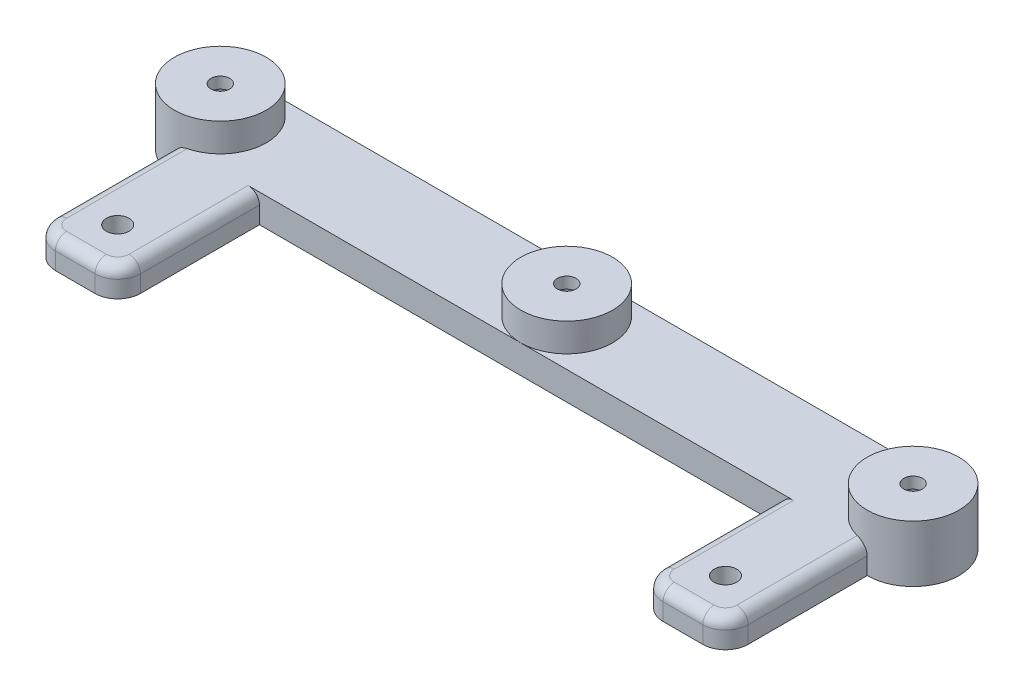
from build123d import *

# Parameters (mm, degrees)
SKETCH1_R           = 8.095
SKETCH1_R_2         = 2.65
SKETCH1_R_3         = 1.645
BOSS_EXTRUDE1_DEPTH = 5
BOSS_EXTRUDE2_START = 5
SKETCH1_3_R         = 8.095
SKETCH1_3_R_2       = 2.65
SKETCH1_3_R_3       = 1.645
BOSS_EXTRUDE2_DEPTH = 5
SKETCH1_4_R         = 2.65
SKETCH1_4_R_2       = 1.645
CUT_EXTRUDE1_DEPTH  = 8
SKETCH2_W           = 15
SKETCH2_H           = 5
BOSS_EXTRUDE3_DEPTH = 25
FILLET1_R           = 4
FILLET2_R           = 2
CUT_EXTRUDE2_REACH  = 79.342
SKETCH3_R           = 2


with BuildPart() as part:
    # Sketch1 → Boss-Extrude1 (new body)
    # profile 1 of 20: a face of its own
    with BuildSketch(Plane(origin=(0, 0, 0), x_dir=(1, 0, 0), z_dir=(0, 1, 0))):
        with BuildLine():
            ThreePointArc((-52.995, 0), (-55.365970606, 5.724029394), (-61.09, 8.095))
            Line((-61.09, 8.095), (-61.09, 2.65))
            ThreePointArc((-61.09, 2.65), (-59.21616703, 1.87383297), (-58.44, 0))
            ThreePointArc((-58.44, 0), (-59.21616703, -1.87383297), (-61.09, -2.65))
            Line((-61.09, -2.65), (-61.09, -8.095))
            ThreePointArc((-61.09, -8.095), (-55.365970606, -5.724029394), (-52.995, 0))
        make_face()
    # profile 2 of 20: a face of its own
    with BuildSketch(Plane(origin=(0, 0, 0), x_dir=(1, 0, 0), z_dir=(0, 1, 0))):
        with BuildLine():
            Line((-61.09, 2.65), (-61.09, 8.095))
            ThreePointArc((-61.09, 8.095), (-69.185, 0), (-61.09, -8.095))
            Line((-61.09, -8.095), (-61.09, -2.65))
            ThreePointArc((-61.09, -2.65), (-63.74, 0), (-61.09, 2.65))
        make_face()
    # profile 3 of 20: a face of its own
    with BuildSketch(Plane(origin=(0, 0, 0), x_dir=(1, 0, 0), z_dir=(0, 1, 0))):
        with BuildLine():
            ThreePointArc((-52.995, 0), (-55.365970606, 5.724029394), (-61.09, 8.095))
            Line((-61.09, 8.095), (-61.09, 2.65))
            ThreePointArc((-61.09, 2.65), (-59.21616703, 1.87383297), (-58.44, 0))
            ThreePointArc((-58.44, 0), (-59.21616703, -1.87383297), (-61.09, -2.65))
            Line((-61.09, -2.65), (-61.09, -8.095))
            ThreePointArc((-61.09, -8.095), (-55.365970606, -5.724029394), (-52.995, 0))
        make_face()
    # profile 4 of 20: a face of its own
    with BuildSketch(Plane(origin=(0, 0, 0), x_dir=(1, 0, 0), z_dir=(0, 1, 0))):
        with BuildLine():
            Line((-61.09, 2.65), (-61.09, 8.095))
            ThreePointArc((-61.09, 8.095), (-69.185, 0), (-61.09, -8.095))
            Line((-61.09, -8.095), (-61.09, -2.65))
            ThreePointArc((-61.09, -2.65), (-63.74, 0), (-61.09, 2.65))
        make_face()
    # profile 5 of 20: a face of its own
    with BuildSketch(Plane(origin=(0, 0, 0), x_dir=(1, 0, 0), z_dir=(0, 1, 0))):
        with BuildLine():
            ThreePointArc((-58.44, 0), (-59.21616703, 1.87383297), (-61.09, 2.65))
            Line((-61.09, 2.65), (-61.09, 1.645))
            ThreePointArc((-61.09, 1.645), (-59.926809345, 1.163190655), (-59.445, 0))
            ThreePointArc((-59.445, 0), (-59.926809345, -1.163190655), (-61.09, -1.645))
            Line((-61.09, -1.645), (-61.09, -2.65))
            ThreePointArc((-61.09, -2.65), (-59.21616703, -1.87383297), (-58.44, 0))
        make_face()
    # profile 6 of 20: a face of its own
    with BuildSketch(Plane(origin=(0, 0, 0), x_dir=(1, 0, 0), z_dir=(0, 1, 0))):
        with BuildLine():
            Line((-61.09, 1.645), (-61.09, 2.65))
            ThreePointArc((-61.09, 2.65), (-63.74, 0), (-61.09, -2.65))
            Line((-61.09, -2.65), (-61.09, -1.645))
            ThreePointArc((-61.09, -1.645), (-62.735, 0), (-61.09, 1.645))
        make_face()
    # profile 7 of 20: a face of its own
    with BuildSketch(Plane(origin=(0, 0, 0), x_dir=(1, 0, 0), z_dir=(0, 1, 0))):
        with BuildLine():
            ThreePointArc((-58.44, 0), (-59.21616703, 1.87383297), (-61.09, 2.65))
            Line((-61.09, 2.65), (-61.09, 1.645))
            ThreePointArc((-61.09, 1.645), (-59.926809345, 1.163190655), (-59.445, 0))
            ThreePointArc((-59.445, 0), (-59.926809345, -1.163190655), (-61.09, -1.645))
            Line((-61.09, -1.645), (-61.09, -2.65))
            ThreePointArc((-61.09, -2.65), (-59.21616703, -1.87383297), (-58.44, 0))
        make_face()
    # profile 8 of 20: a face of its own
    with BuildSketch(Plane(origin=(0, 0, 0), x_dir=(1, 0, 0), z_dir=(0, 1, 0))):
        with BuildLine():
            Line((-61.09, 1.645), (-61.09, 2.65))
            ThreePointArc((-61.09, 2.65), (-63.74, 0), (-61.09, -2.65))
            Line((-61.09, -2.65), (-61.09, -1.645))
            ThreePointArc((-61.09, -1.645), (-62.735, 0), (-61.09, 1.645))
        make_face()
    # profile 9 of 20: a face of its own
    with BuildSketch(Plane(origin=(0, 0, 0), x_dir=(1, 0, 0), z_dir=(0, 1, 0))):
        with BuildLine():
            Line((-3.7e-08, 8.095), (-61.09, 8.095))
            ThreePointArc((-61.09, 8.095), (-55.365970606, 5.724029394), (-52.995, 0))
            ThreePointArc((-52.995, 0), (-55.365970606, -5.724029394), (-61.09, -8.095))
            Line((-61.09, -8.095), (4.2e-08, -8.095))
            ThreePointArc((4.2e-08, -8.095), (-8.095, -4e-08), (-3.7e-08, 8.095))
        make_face()
    # profile 10 of 20: a face of its own
    with BuildSketch(Plane(origin=(0, 0, 0), x_dir=(1, 0, 0), z_dir=(0, 1, 0))):
        Circle(SKETCH1_R)
        Circle(SKETCH1_R_2, mode=Mode.SUBTRACT)
    # profile 11 of 20: a face of its own
    with BuildSketch(Plane(origin=(0, 0, 0), x_dir=(1, 0, 0), z_dir=(0, 1, 0))):
        Circle(SKETCH1_R_2)
        with Locations(Location((0, 0, 0), (0, 0, 270))):
            Circle(SKETCH1_R_3, mode=Mode.SUBTRACT)
    # profile 12 of 20: a face of its own
    with BuildSketch(Plane(origin=(0, 0, 0), x_dir=(1, 0, 0), z_dir=(0, 1, 0))):
        with BuildLine():
            Line((61.09, 8.095), (-3.7e-08, 8.095))
            ThreePointArc((-3.7e-08, 8.095), (5.724029381, 5.724029407), (8.095, 0))
            ThreePointArc((8.095, 0), (5.724029409, -5.724029379), (4.2e-08, -8.095))
            Line((4.2e-08, -8.095), (61.09, -8.095))
            ThreePointArc((61.09, -8.095), (52.995, 0), (61.09, 8.095))
        make_face()
    # profile 13 of 20: a face of its own
    with BuildSketch(Plane(origin=(0, 0, 0), x_dir=(1, 0, 0), z_dir=(0, 1, 0))):
        with BuildLine():
            ThreePointArc((69.185, 0), (66.814029394, 5.724029394), (61.09, 8.095))
            Line((61.09, 8.095), (61.09, 2.65))
            ThreePointArc((61.09, 2.65), (62.96383297, 1.87383297), (63.74, 0))
            ThreePointArc((63.74, 0), (62.96383297, -1.87383297), (61.09, -2.65))
            Line((61.09, -2.65), (61.09, -8.095))
            ThreePointArc((61.09, -8.095), (66.814029394, -5.724029394), (69.185, 0))
        make_face()
    # profile 14 of 20: a face of its own
    with BuildSketch(Plane(origin=(0, 0, 0), x_dir=(1, 0, 0), z_dir=(0, 1, 0))):
        with BuildLine():
            Line((61.09, 2.65), (61.09, 8.095))
            ThreePointArc((61.09, 8.095), (52.995, 0), (61.09, -8.095))
            Line((61.09, -8.095), (61.09, -2.65))
            ThreePointArc((61.09, -2.65), (58.44, 0), (61.09, 2.65))
        make_face()
    # profile 15 of 20: a face of its own
    with BuildSketch(Plane(origin=(0, 0, 0), x_dir=(1, 0, 0), z_dir=(0, 1, 0))):
        with BuildLine():
            ThreePointArc((69.185, 0), (66.814029394, 5.724029394), (61.09, 8.095))
            Line((61.09, 8.095), (61.09, 2.65))
            ThreePointArc((61.09, 2.65), (62.96383297, 1.87383297), (63.74, 0))
            ThreePointArc((63.74, 0), (62.96383297, -1.87383297), (61.09, -2.65))
            Line((61.09, -2.65), (61.09, -8.095))
            ThreePointArc((61.09, -8.095), (66.814029394, -5.724029394), (69.185, 0))
        make_face()
    # profile 16 of 20: a face of its own
    with BuildSketch(Plane(origin=(0, 0, 0), x_dir=(1, 0, 0), z_dir=(0, 1, 0))):
        with BuildLine():
            Line((61.09, 2.65), (61.09, 8.095))
            ThreePointArc((61.09, 8.095), (52.995, 0), (61.09, -8.095))
            Line((61.09, -8.095), (61.09, -2.65))
            ThreePointArc((61.09, -2.65), (58.44, 0), (61.09, 2.65))
        make_face()
    # profile 17 of 20: a face of its own
    with BuildSketch(Plane(origin=(0, 0, 0), x_dir=(1, 0, 0), z_dir=(0, 1, 0))):
        with BuildLine():
            ThreePointArc((63.74, 0), (62.96383297, 1.87383297), (61.09, 2.65))
            Line((61.09, 2.65), (61.09, 1.645))
            ThreePointArc((61.09, 1.645), (62.253190655, 1.163190655), (62.735, 0))
            ThreePointArc((62.735, 0), (62.253190655, -1.163190655), (61.09, -1.645))
            Line((61.09, -1.645), (61.09, -2.65))
            ThreePointArc((61.09, -2.65), (62.96383297, -1.87383297), (63.74, 0))
        make_face()
    # profile 18 of 20: a face of its own
    with BuildSketch(Plane(origin=(0, 0, 0), x_dir=(1, 0, 0), z_dir=(0, 1, 0))):
        with BuildLine():
            Line((61.09, 1.645), (61.09, 2.65))
            ThreePointArc((61.09, 2.65), (58.44, 0), (61.09, -2.65))
            Line((61.09, -2.65), (61.09, -1.645))
            ThreePointArc((61.09, -1.645), (59.445, 0), (61.09, 1.645))
        make_face()
    # profile 19 of 20: a face of its own
    with BuildSketch(Plane(origin=(0, 0, 0), x_dir=(1, 0, 0), z_dir=(0, 1, 0))):
        with BuildLine():
            ThreePointArc((63.74, 0), (62.96383297, 1.87383297), (61.09, 2.65))
            Line((61.09, 2.65), (61.09, 1.645))
            ThreePointArc((61.09, 1.645), (62.253190655, 1.163190655), (62.735, 0))
            ThreePointArc((62.735, 0), (62.253190655, -1.163190655), (61.09, -1.645))
            Line((61.09, -1.645), (61.09, -2.65))
            ThreePointArc((61.09, -2.65), (62.96383297, -1.87383297), (63.74, 0))
        make_face()
    # profile 20 of 20: a face of its own
    with BuildSketch(Plane(origin=(0, 0, 0), x_dir=(1, 0, 0), z_dir=(0, 1, 0))):
        with BuildLine():
            Line((61.09, 1.645), (61.09, 2.65))
            ThreePointArc((61.09, 2.65), (58.44, 0), (61.09, -2.65))
            Line((61.09, -2.65), (61.09, -1.645))
            ThreePointArc((61.09, -1.645), (59.445, 0), (61.09, 1.645))
        make_face()
    extrude(amount=BOSS_EXTRUDE1_DEPTH)

    # Sketch1<3> → Boss-Extrude2 (add)
    # profile 1 of 18: a face of its own
    with BuildSketch(Plane(origin=(0, 0, 0), x_dir=(1, 0, 0), z_dir=(0, 1, 0)).offset(BOSS_EXTRUDE2_START)):
        with BuildLine():
            ThreePointArc((-52.995, 0), (-55.365970606, 5.724029394), (-61.09, 8.095))
            Line((-61.09, 8.095), (-61.09, 2.65))
            ThreePointArc((-61.09, 2.65), (-59.21616703, 1.87383297), (-58.44, 0))
            ThreePointArc((-58.44, 0), (-59.21616703, -1.87383297), (-61.09, -2.65))
            Line((-61.09, -2.65), (-61.09, -8.095))
            ThreePointArc((-61.09, -8.095), (-55.365970606, -5.724029394), (-52.995, 0))
        make_face()
    # profile 2 of 18: a face of its own
    with BuildSketch(Plane(origin=(0, 0, 0), x_dir=(1, 0, 0), z_dir=(0, 1, 0)).offset(BOSS_EXTRUDE2_START)):
        with BuildLine():
            Line((-61.09, 2.65), (-61.09, 8.095))
            ThreePointArc((-61.09, 8.095), (-69.185, 0), (-61.09, -8.095))
            Line((-61.09, -8.095), (-61.09, -2.65))
            ThreePointArc((-61.09, -2.65), (-63.74, 0), (-61.09, 2.65))
        make_face()
    # profile 3 of 18: a face of its own
    with BuildSketch(Plane(origin=(0, 0, 0), x_dir=(1, 0, 0), z_dir=(0, 1, 0)).offset(BOSS_EXTRUDE2_START)):
        with BuildLine():
            ThreePointArc((-58.44, 0), (-59.21616703, 1.87383297), (-61.09, 2.65))
            Line((-61.09, 2.65), (-61.09, 1.645))
            ThreePointArc((-61.09, 1.645), (-59.926809345, 1.163190655), (-59.445, 0))
            ThreePointArc((-59.445, 0), (-59.926809345, -1.163190655), (-61.09, -1.645))
            Line((-61.09, -1.645), (-61.09, -2.65))
            ThreePointArc((-61.09, -2.65), (-59.21616703, -1.87383297), (-58.44, 0))
        make_face()
    # profile 4 of 18: a face of its own
    with BuildSketch(Plane(origin=(0, 0, 0), x_dir=(1, 0, 0), z_dir=(0, 1, 0)).offset(BOSS_EXTRUDE2_START)):
        with BuildLine():
            Line((-61.09, 1.645), (-61.09, 2.65))
            ThreePointArc((-61.09, 2.65), (-63.74, 0), (-61.09, -2.65))
            Line((-61.09, -2.65), (-61.09, -1.645))
            ThreePointArc((-61.09, -1.645), (-62.735, 0), (-61.09, 1.645))
        make_face()
    # profile 5 of 18: a face of its own
    with BuildSketch(Plane(origin=(0, 0, 0), x_dir=(1, 0, 0), z_dir=(0, 1, 0)).offset(BOSS_EXTRUDE2_START)):
        with BuildLine():
            ThreePointArc((-58.44, 0), (-59.21616703, 1.87383297), (-61.09, 2.65))
            Line((-61.09, 2.65), (-61.09, 1.645))
            ThreePointArc((-61.09, 1.645), (-59.926809345, 1.163190655), (-59.445, 0))
            ThreePointArc((-59.445, 0), (-59.926809345, -1.163190655), (-61.09, -1.645))
            Line((-61.09, -1.645), (-61.09, -2.65))
            ThreePointArc((-61.09, -2.65), (-59.21616703, -1.87383297), (-58.44, 0))
        make_face()
    # profile 6 of 18: a face of its own
    with BuildSketch(Plane(origin=(0, 0, 0), x_dir=(1, 0, 0), z_dir=(0, 1, 0)).offset(BOSS_EXTRUDE2_START)):
        with BuildLine():
            Line((-61.09, 1.645), (-61.09, 2.65))
            ThreePointArc((-61.09, 2.65), (-63.74, 0), (-61.09, -2.65))
            Line((-61.09, -2.65), (-61.09, -1.645))
            ThreePointArc((-61.09, -1.645), (-62.735, 0), (-61.09, 1.645))
        make_face()
    # profile 7 of 18: a face of its own
    with BuildSketch(Plane(origin=(0, 0, 0), x_dir=(1, 0, 0), z_dir=(0, 1, 0)).offset(BOSS_EXTRUDE2_START)):
        with BuildLine():
            ThreePointArc((-52.995, 0), (-55.365970606, 5.724029394), (-61.09, 8.095))
            Line((-61.09, 8.095), (-61.09, 2.65))
            ThreePointArc((-61.09, 2.65), (-59.21616703, 1.87383297), (-58.44, 0))
            ThreePointArc((-58.44, 0), (-59.21616703, -1.87383297), (-61.09, -2.65))
            Line((-61.09, -2.65), (-61.09, -8.095))
            ThreePointArc((-61.09, -8.095), (-55.365970606, -5.724029394), (-52.995, 0))
        make_face()
    # profile 8 of 18: a face of its own
    with BuildSketch(Plane(origin=(0, 0, 0), x_dir=(1, 0, 0), z_dir=(0, 1, 0)).offset(BOSS_EXTRUDE2_START)):
        with BuildLine():
            Line((-61.09, 2.65), (-61.09, 8.095))
            ThreePointArc((-61.09, 8.095), (-69.185, 0), (-61.09, -8.095))
            Line((-61.09, -8.095), (-61.09, -2.65))
            ThreePointArc((-61.09, -2.65), (-63.74, 0), (-61.09, 2.65))
        make_face()
    # profile 9 of 18: a face of its own
    with BuildSketch(Plane(origin=(0, 0, 0), x_dir=(1, 0, 0), z_dir=(0, 1, 0)).offset(BOSS_EXTRUDE2_START)):
        with Locations(Location((0, 0, 0), (0, 0, 270))):
            Circle(SKETCH1_3_R)
        Circle(SKETCH1_3_R_2, mode=Mode.SUBTRACT)
    # profile 10 of 18: a face of its own
    with BuildSketch(Plane(origin=(0, 0, 0), x_dir=(1, 0, 0), z_dir=(0, 1, 0)).offset(BOSS_EXTRUDE2_START)):
        Circle(SKETCH1_3_R_2)
        with Locations(Location((0, 0, 0), (0, 0, 270))):
            Circle(SKETCH1_3_R_3, mode=Mode.SUBTRACT)
    # profile 11 of 18: a face of its own
    with BuildSketch(Plane(origin=(0, 0, 0), x_dir=(1, 0, 0), z_dir=(0, 1, 0)).offset(BOSS_EXTRUDE2_START)):
        with BuildLine():
            ThreePointArc((69.185, 0), (66.814029394, 5.724029394), (61.09, 8.095))
            Line((61.09, 8.095), (61.09, 2.65))
            ThreePointArc((61.09, 2.65), (62.96383297, 1.87383297), (63.74, 0))
            ThreePointArc((63.74, 0), (62.96383297, -1.87383297), (61.09, -2.65))
            Line((61.09, -2.65), (61.09, -8.095))
            ThreePointArc((61.09, -8.095), (66.814029394, -5.724029394), (69.185, 0))
        make_face()
    # profile 12 of 18: a face of its own
    with BuildSketch(Plane(origin=(0, 0, 0), x_dir=(1, 0, 0), z_dir=(0, 1, 0)).offset(BOSS_EXTRUDE2_START)):
        with BuildLine():
            Line((61.09, 2.65), (61.09, 8.095))
            ThreePointArc((61.09, 8.095), (52.995, 0), (61.09, -8.095))
            Line((61.09, -8.095), (61.09, -2.65))
            ThreePointArc((61.09, -2.65), (58.44, 0), (61.09, 2.65))
        make_face()
    # profile 13 of 18: a face of its own
    with BuildSketch(Plane(origin=(0, 0, 0), x_dir=(1, 0, 0), z_dir=(0, 1, 0)).offset(BOSS_EXTRUDE2_START)):
        with BuildLine():
            ThreePointArc((69.185, 0), (66.814029394, 5.724029394), (61.09, 8.095))
            Line((61.09, 8.095), (61.09, 2.65))
            ThreePointArc((61.09, 2.65), (62.96383297, 1.87383297), (63.74, 0))
            ThreePointArc((63.74, 0), (62.96383297, -1.87383297), (61.09, -2.65))
            Line((61.09, -2.65), (61.09, -8.095))
            ThreePointArc((61.09, -8.095), (66.814029394, -5.724029394), (69.185, 0))
        make_face()
    # profile 14 of 18: a face of its own
    with BuildSketch(Plane(origin=(0, 0, 0), x_dir=(1, 0, 0), z_dir=(0, 1, 0)).offset(BOSS_EXTRUDE2_START)):
        with BuildLine():
            Line((61.09, 2.65), (61.09, 8.095))
            ThreePointArc((61.09, 8.095), (52.995, 0), (61.09, -8.095))
            Line((61.09, -8.095), (61.09, -2.65))
            ThreePointArc((61.09, -2.65), (58.44, 0), (61.09, 2.65))
        make_face()
    # profile 15 of 18: a face of its own
    with BuildSketch(Plane(origin=(0, 0, 0), x_dir=(1, 0, 0), z_dir=(0, 1, 0)).offset(BOSS_EXTRUDE2_START)):
        with BuildLine():
            ThreePointArc((63.74, 0), (62.96383297, 1.87383297), (61.09, 2.65))
            Line((61.09, 2.65), (61.09, 1.645))
            ThreePointArc((61.09, 1.645), (62.253190655, 1.163190655), (62.735, 0))
            ThreePointArc((62.735, 0), (62.253190655, -1.163190655), (61.09, -1.645))
            Line((61.09, -1.645), (61.09, -2.65))
            ThreePointArc((61.09, -2.65), (62.96383297, -1.87383297), (63.74, 0))
        make_face()
    # profile 16 of 18: a face of its own
    with BuildSketch(Plane(origin=(0, 0, 0), x_dir=(1, 0, 0), z_dir=(0, 1, 0)).offset(BOSS_EXTRUDE2_START)):
        with BuildLine():
            Line((61.09, 1.645), (61.09, 2.65))
            ThreePointArc((61.09, 2.65), (58.44, 0), (61.09, -2.65))
            Line((61.09, -2.65), (61.09, -1.645))
            ThreePointArc((61.09, -1.645), (59.445, 0), (61.09, 1.645))
        make_face()
    # profile 17 of 18: a face of its own
    with BuildSketch(Plane(origin=(0, 0, 0), x_dir=(1, 0, 0), z_dir=(0, 1, 0)).offset(BOSS_EXTRUDE2_START)):
        with BuildLine():
            ThreePointArc((63.74, 0), (62.96383297, 1.87383297), (61.09, 2.65))
            Line((61.09, 2.65), (61.09, 1.645))
            ThreePointArc((61.09, 1.645), (62.253190655, 1.163190655), (62.735, 0))
            ThreePointArc((62.735, 0), (62.253190655, -1.163190655), (61.09, -1.645))
            Line((61.09, -1.645), (61.09, -2.65))
            ThreePointArc((61.09, -2.65), (62.96383297, -1.87383297), (63.74, 0))
        make_face()
    # profile 18 of 18: a face of its own
    with BuildSketch(Plane(origin=(0, 0, 0), x_dir=(1, 0, 0), z_dir=(0, 1, 0)).offset(BOSS_EXTRUDE2_START)):
        with BuildLine():
            Line((61.09, 1.645), (61.09, 2.65))
            ThreePointArc((61.09, 2.65), (58.44, 0), (61.09, -2.65))
            Line((61.09, -2.65), (61.09, -1.645))
            ThreePointArc((61.09, -1.645), (59.445, 0), (61.09, 1.645))
        make_face()
    extrude(amount=BOSS_EXTRUDE2_DEPTH)

    # Sketch1<4> → Cut-Extrude1 (cut)
    # profile 1 of 9: a face of its own
    with BuildSketch(Plane(origin=(0, 0, 0), x_dir=(1, 0, 0), z_dir=(0, 1, 0))):
        with BuildLine():
            ThreePointArc((-58.44, 0), (-59.21616703, 1.87383297), (-61.09, 2.65))
            Line((-61.09, 2.65), (-61.09, 1.645))
            ThreePointArc((-61.09, 1.645), (-59.926809345, 1.163190655), (-59.445, 0))
            ThreePointArc((-59.445, 0), (-59.926809345, -1.163190655), (-61.09, -1.645))
            Line((-61.09, -1.645), (-61.09, -2.65))
            ThreePointArc((-61.09, -2.65), (-59.21616703, -1.87383297), (-58.44, 0))
        make_face()
    # profile 2 of 9: a face of its own
    with BuildSketch(Plane(origin=(0, 0, 0), x_dir=(1, 0, 0), z_dir=(0, 1, 0))):
        with BuildLine():
            Line((-61.09, 1.645), (-61.09, 2.65))
            ThreePointArc((-61.09, 2.65), (-63.74, 0), (-61.09, -2.65))
            Line((-61.09, -2.65), (-61.09, -1.645))
            ThreePointArc((-61.09, -1.645), (-62.735, 0), (-61.09, 1.645))
        make_face()
    # profile 3 of 9: a face of its own
    with BuildSketch(Plane(origin=(0, 0, 0), x_dir=(1, 0, 0), z_dir=(0, 1, 0))):
        with BuildLine():
            ThreePointArc((-58.44, 0), (-59.21616703, 1.87383297), (-61.09, 2.65))
            Line((-61.09, 2.65), (-61.09, 1.645))
            ThreePointArc((-61.09, 1.645), (-59.926809345, 1.163190655), (-59.445, 0))
            ThreePointArc((-59.445, 0), (-59.926809345, -1.163190655), (-61.09, -1.645))
            Line((-61.09, -1.645), (-61.09, -2.65))
            ThreePointArc((-61.09, -2.65), (-59.21616703, -1.87383297), (-58.44, 0))
        make_face()
    # profile 4 of 9: a face of its own
    with BuildSketch(Plane(origin=(0, 0, 0), x_dir=(1, 0, 0), z_dir=(0, 1, 0))):
        with BuildLine():
            Line((-61.09, 1.645), (-61.09, 2.65))
            ThreePointArc((-61.09, 2.65), (-63.74, 0), (-61.09, -2.65))
            Line((-61.09, -2.65), (-61.09, -1.645))
            ThreePointArc((-61.09, -1.645), (-62.735, 0), (-61.09, 1.645))
        make_face()
    # profile 5 of 9: a face of its own
    with BuildSketch(Plane(origin=(0, 0, 0), x_dir=(1, 0, 0), z_dir=(0, 1, 0))):
        with Locations(Location((0, 0, 0), (0, 0, 270))):
            Circle(SKETCH1_4_R)
        with Locations(Location((0, 0, 0), (0, 0, 270))):
            Circle(SKETCH1_4_R_2, mode=Mode.SUBTRACT)
    # profile 6 of 9: a face of its own
    with BuildSketch(Plane(origin=(0, 0, 0), x_dir=(1, 0, 0), z_dir=(0, 1, 0))):
        with BuildLine():
            ThreePointArc((63.74, 0), (62.96383297, 1.87383297), (61.09, 2.65))
            Line((61.09, 2.65), (61.09, 1.645))
            ThreePointArc((61.09, 1.645), (62.253190655, 1.163190655), (62.735, 0))
            ThreePointArc((62.735, 0), (62.253190655, -1.163190655), (61.09, -1.645))
            Line((61.09, -1.645), (61.09, -2.65))
            ThreePointArc((61.09, -2.65), (62.96383297, -1.87383297), (63.74, 0))
        make_face()
    # profile 7 of 9: a face of its own
    with BuildSketch(Plane(origin=(0, 0, 0), x_dir=(1, 0, 0), z_dir=(0, 1, 0))):
        with BuildLine():
            Line((61.09, 1.645), (61.09, 2.65))
            ThreePointArc((61.09, 2.65), (58.44, 0), (61.09, -2.65))
            Line((61.09, -2.65), (61.09, -1.645))
            ThreePointArc((61.09, -1.645), (59.445, 0), (61.09, 1.645))
        make_face()
    # profile 8 of 9: a face of its own
    with BuildSketch(Plane(origin=(0, 0, 0), x_dir=(1, 0, 0), z_dir=(0, 1, 0))):
        with BuildLine():
            ThreePointArc((63.74, 0), (62.96383297, 1.87383297), (61.09, 2.65))
            Line((61.09, 2.65), (61.09, 1.645))
            ThreePointArc((61.09, 1.645), (62.253190655, 1.163190655), (62.735, 0))
            ThreePointArc((62.735, 0), (62.253190655, -1.163190655), (61.09, -1.645))
            Line((61.09, -1.645), (61.09, -2.65))
            ThreePointArc((61.09, -2.65), (62.96383297, -1.87383297), (63.74, 0))
        make_face()
    # profile 9 of 9: a face of its own
    with BuildSketch(Plane(origin=(0, 0, 0), x_dir=(1, 0, 0), z_dir=(0, 1, 0))):
        with BuildLine():
            Line((61.09, 1.645), (61.09, 2.65))
            ThreePointArc((61.09, 2.65), (58.44, 0), (61.09, -2.65))
            Line((61.09, -2.65), (61.09, -1.645))
            ThreePointArc((61.09, -1.645), (59.445, 0), (61.09, 1.645))
        make_face()
    extrude(amount=CUT_EXTRUDE1_DEPTH, mode=Mode.SUBTRACT)

    # Sketch2 → Boss-Extrude3 (add)
    with BuildSketch(Plane.XY.offset(8.095)):
        with Locations((-53.59, 2.5)):
            Rectangle(SKETCH2_W, SKETCH2_H)
        with Locations((53.59, 2.5)):
            Rectangle(SKETCH2_W, SKETCH2_H)
    extrude(amount=BOSS_EXTRUDE3_DEPTH)

    # Fillet1
    fillet1_edges = [part.edges().sort_by_distance(p)[0] for p in [
        (-61.09, 2.5, 33.095),
        (-46.09, 2.5, 33.095),
        (61.09, 2.5, 33.095),
        (46.09, 2.5, 33.095),
    ]]
    fillet(fillet1_edges, radius=FILLET1_R)

    # Fillet2
    fillet2_edges = [part.edges().sort_by_distance(p)[0] for p in [
        (-53.59, 5, 33.095),
        (-61.09, 5, 18.595),
        (-46.09, 5, 18.595),
        (-47.261572875, 5, 31.923427125),
        (-59.918427125, 5, 31.923427125),
        (53.59, 5, 33.095),
        (46.09, 5, 18.595),
        (61.09, 5, 18.595),
        (47.261572875, 5, 31.923427125),
        (59.918427125, 5, 31.923427125),
    ]]
    fillet(fillet2_edges, radius=FILLET2_R)

    # Sketch3 → Cut-Extrude2 (cut, up to next)
    with BuildSketch(Plane.XZ, mode=Mode.PRIVATE) as cut_extrude2_sk1:
        with Locations(Location((-53.59, 25.595, 0), (0, 0, 270))):
            Circle(SKETCH3_R)
    cut_extrude2_tool1 = extrude(cut_extrude2_sk1.sketch, amount=-CUT_EXTRUDE2_REACH, mode=Mode.PRIVATE) & part.part
    # Sketch3 → Cut-Extrude2 (cut, up to next)
    with BuildSketch(Plane.XZ, mode=Mode.PRIVATE) as cut_extrude2_sk2:
        with Locations(Location((53.59, 25.595, 0), (0, 0, 270))):
            Circle(SKETCH3_R)
    cut_extrude2_tool2 = extrude(cut_extrude2_sk2.sketch, amount=-CUT_EXTRUDE2_REACH, mode=Mode.PRIVATE) & part.part
    add(cut_extrude2_tool1.solids().sort_by_distance((-53.59, 0, 25.595))[0], mode=Mode.SUBTRACT)
    add(cut_extrude2_tool2.solids().sort_by_distance((53.59, 0, 25.595))[0], mode=Mode.SUBTRACT)


solid = part.part
